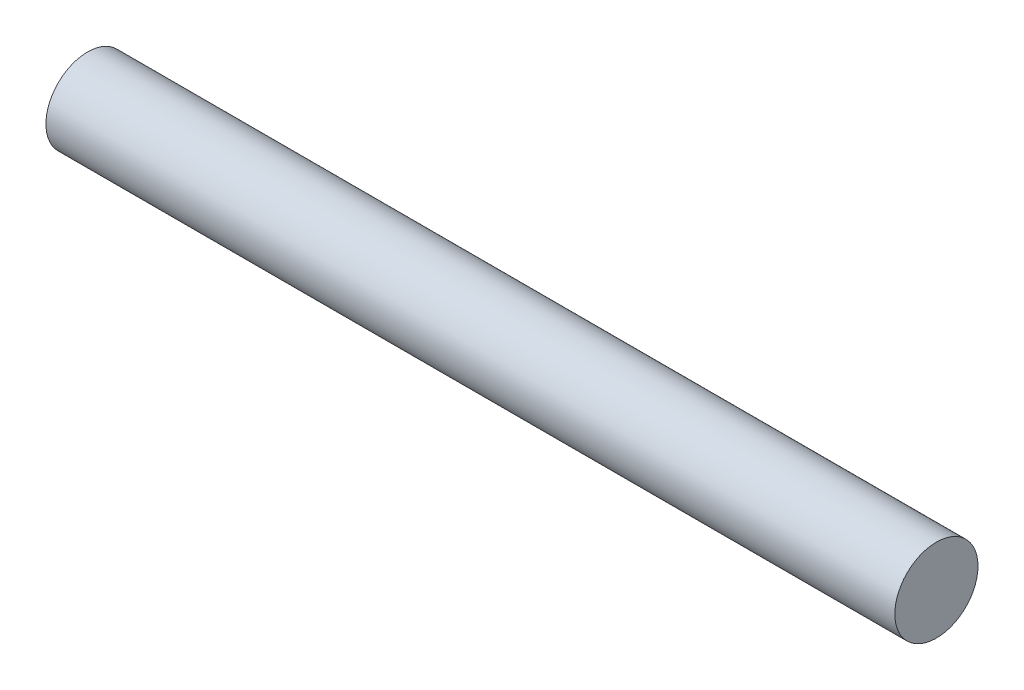
from build123d import *

# Parameters (mm, degrees)
SKETCH1_R           = 4.9
BOSS_EXTRUDE1_DEPTH = 100
CUT_EXTRUDE1_DEPTH  = 10


with BuildPart() as part:
    # Sketch1 → Boss-Extrude1 (new body)
    with BuildSketch(Plane.YZ):
        with Locations(Location((0, 0, 0), (0, 0, 270))):
            Circle(SKETCH1_R)
    extrude(amount=BOSS_EXTRUDE1_DEPTH)

    # Sketch2 → Cut-Extrude1 (cut)
    with BuildSketch(Plane(origin=(0, 0, 0), x_dir=(0, -1, 0), z_dir=(-1, 0, 0))):
        with BuildLine():
            Line((-1.85, -1.280624847), (-1.85, 1.280624847))
            ThreePointArc((-1.85, 1.280624847), (0, 2.25), (1.85, 1.280624847))
            Line((1.85, 1.280624847), (1.85, -1.280624847))
            ThreePointArc((1.85, -1.280624847), (0, -2.25), (-1.85, -1.280624847))
        make_face()
    extrude(amount=-CUT_EXTRUDE1_DEPTH, mode=Mode.SUBTRACT)


solid = part.part
